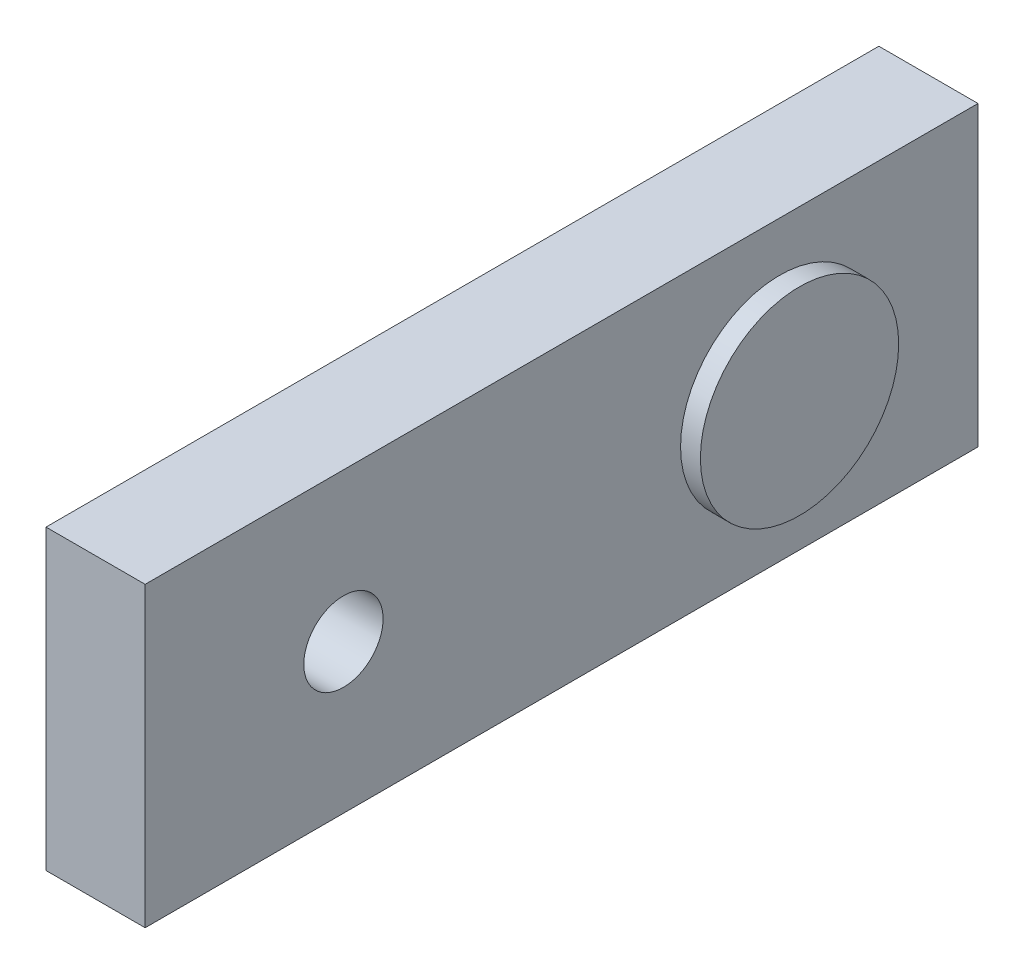
from build123d import *

# Parameters (mm, degrees)
SKETCH1_W               = 50
SKETCH1_H               = 150
BOSS_EXTRUDE1_DEPTH     = 420
CUT_EXTRUDE1_DEPTH      = 400
CUT_EXTRUDE1_DEPTH_BACK = 400
SKETCH2_R               = 20
SKETCH3_R               = 50
BOSS_EXTRUDE2_DEPTH     = 10


with BuildPart() as part:
    # Sketch1 → Boss-Extrude1 (new body)
    with BuildSketch(Plane.XY):
        Rectangle(SKETCH1_W, SKETCH1_H)
    extrude(amount=BOSS_EXTRUDE1_DEPTH)

    # Sketch2 → Cut-Extrude1 (cut, two sides: drawn at the far end of the back side and taken through both)
    with BuildSketch(Plane(origin=(25, 0, 0), x_dir=(0, 0, -1), z_dir=(1, 0, 0)).offset(-CUT_EXTRUDE1_DEPTH_BACK)):
        with Locations((-320, 0)):
            Circle(SKETCH2_R)
    extrude(amount=CUT_EXTRUDE1_DEPTH + CUT_EXTRUDE1_DEPTH_BACK, mode=Mode.SUBTRACT)

    # Sketch3 → Boss-Extrude2 (add)
    with BuildSketch(Plane(origin=(25, 0, 0), x_dir=(0, 0, -1), z_dir=(1, 0, 0))):
        with Locations((-100, 0)):
            Circle(SKETCH3_R)
    extrude(amount=BOSS_EXTRUDE2_DEPTH)


solid = part.part
